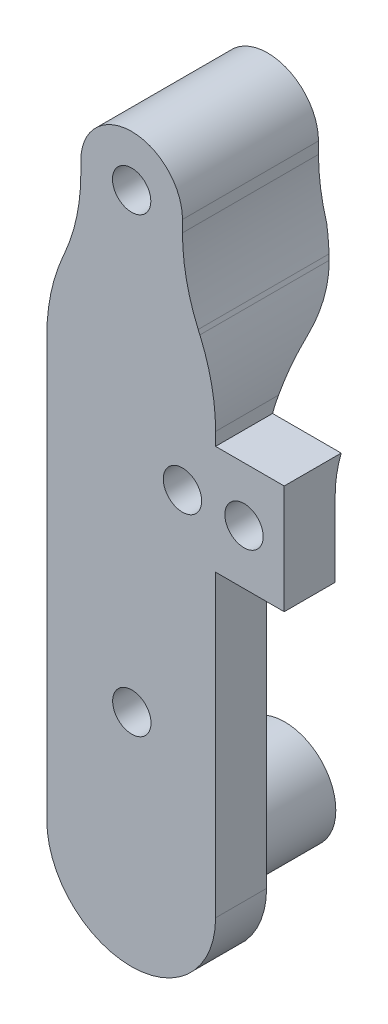
from build123d import *

# Parameters (mm, degrees)
SKETCH1_R           = 1.7907
BOSS_EXTRUDE1_DEPTH = 12.7
CUT_EXTRUDE1_DEPTH  = 43.908371508
SKETCH7_R           = 4.7625
BOSS_EXTRUDE3_DEPTH = 9.525


with BuildPart() as part:
    # Sketch1 → Boss-Extrude1 (new body)
    with BuildSketch(Plane.XY):
        with BuildLine():
            ThreePointArc((-5.89797239, 28.334249775), (-10.644578231, 33.080855616), (-15.391184073, 28.334249775))
            Line((-15.391184073, 28.334249775), (-15.391184073, 27.2867057))
            ThreePointArc((-15.391184073, 27.2867057), (-15.767187067, 23.64949685), (-16.879292984, 20.16612393))
            Line((-16.879292984, 20.16612393), (-17.078075162, 19.711310306))
            ThreePointArc((-17.078075162, 19.711310306), (-18.190181079, 16.227937386), (-18.566184073, 12.590728536))
            Line((-18.566184073, 12.590728536), (-18.566184073, -26.593250225))
            ThreePointArc((-18.566184073, -26.593250225), (-10.68587239, -34.473561908), (-2.805560707, -26.593250225))
            Line((-2.805560707, -26.593250225), (-2.805560707, 1.359449775))
            Line((-2.805560707, 1.359449775), (3.60162761, 1.359449775))
            Line((3.60162761, 1.359449775), (3.60162761, 11.531317118))
            Line((3.60162761, 11.531317118), (-2.805560707, 11.531317118))
            Line((-2.805560707, 11.531317118), (-2.805560707, 12.738028185))
            ThreePointArc((-2.805560707, 12.738028185), (-3.176236758, 16.349653807), (-4.272809259, 19.810689652))
            Line((-4.272809259, 19.810689652), (-4.430723837, 20.174911983))
            ThreePointArc((-4.430723837, 20.174911983), (-5.527296339, 23.635947828), (-5.89797239, 27.24757345))
            Line((-5.89797239, 27.24757345), (-5.89797239, 28.334249775))
        make_face()
        with Locations((-10.644578231, 28.334249775)):
            Circle(SKETCH1_R, mode=Mode.SUBTRACT)
        with Locations((-0.151184073, 6.451317118)):
            Circle(SKETCH1_R, mode=Mode.SUBTRACT)
        with Locations((-10.628684073, -13.868682882)):
            Circle(SKETCH1_R, mode=Mode.SUBTRACT)
        with Locations((-5.89797239, 6.451317118)):
            Circle(SKETCH1_R, mode=Mode.SUBTRACT)
    extrude(amount=BOSS_EXTRUDE1_DEPTH)

    # Sketch5 → Cut-Extrude1 (cut, through all)
    with BuildSketch(Plane.ZY.offset(18.566184073)):
        with BuildLine():
            ThreePointArc((7.9375, 8.453324113), (7.028090228, 12.340648325), (4.488615022, 15.421132271))
            Line((4.488615022, 15.421132271), (3.372744888, 16.272169226))
            ThreePointArc((3.372744888, 16.272169226), (1.106569634, 18.843459634), (0, 22.08731356))
            Line((0, 22.08731356), (0, -34.473561908))
            Line((0, -34.473561908), (7.9375, -34.473561908))
            Line((7.9375, -34.473561908), (7.9375, 8.453324113))
        make_face()
    extrude(amount=-CUT_EXTRUDE1_DEPTH, mode=Mode.SUBTRACT)

    # Sketch7 → Boss-Extrude3 (add)
    with BuildSketch(Plane(origin=(0, 0, 7.9375), x_dir=(-1, 0, 0), z_dir=(0, 0, -1))):
        with Locations((10.628684073, -26.568682882)):
            Circle(SKETCH7_R)
    extrude(amount=BOSS_EXTRUDE3_DEPTH)


solid = part.part
